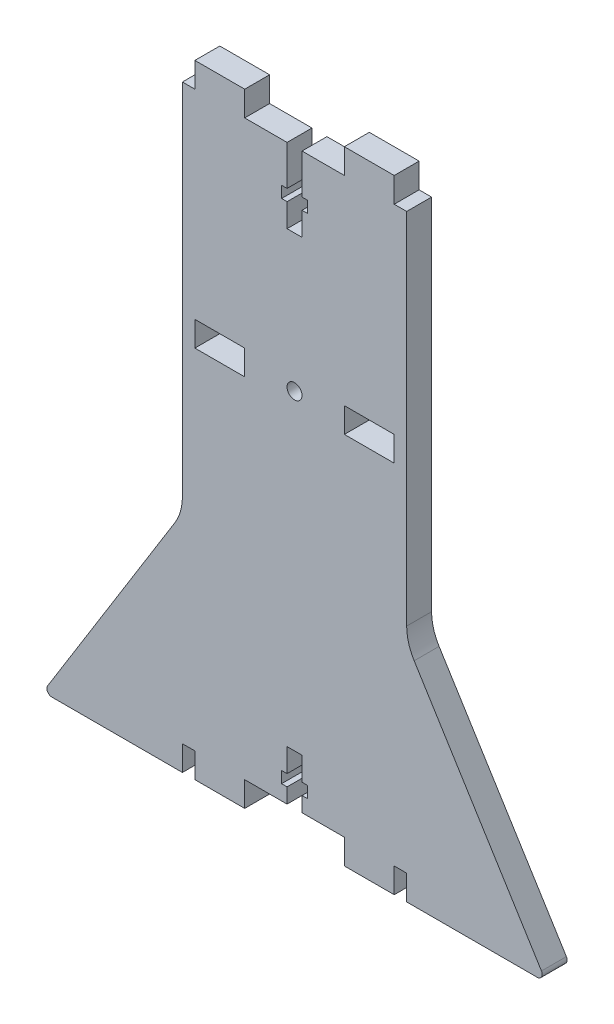
from build123d import *

# Parameters (mm, degrees)
BOSS_EXTRUDE1_DEPTH = 5
SKETCH2_R           = 1.5
SKETCH2_W           = 10
SKETCH2_H           = 5
CUT_EXTRUDE1_DEPTH  = 10
FILLET1_R           = 10
FILLET2_R           = 1


with BuildPart() as part:
    # Sketch1 → Boss-Extrude1 (new body)
    with BuildSketch(Plane.XY):
        Polygon((-32.518889855, -56.191512275), (-30.018889855, -56.191512275), (-30.018889855, -61.191512275), (-20.018889855, -61.191512275), (-20.018889855, -56.191512275), (-11.518889855, -56.191512275), (-11.518889855, -53.191512275), (-12.618889855, -53.191512275), (-12.618889855, -50.891512275), (-11.518889855, -50.891512275), (-11.518889855, -46.191512275), (-8.518889855, -46.191512275), (-8.518889855, -50.891512275), (-7.418889855, -50.891512275), (-7.418889855, -53.191512275), (-8.518889855, -53.191512275), (-8.518889855, -56.191512275), (-0.018889855, -56.191512275), (-0.018889855, -61.191512275), (9.981110145, -61.191512275), (9.981110145, -56.191512275), (12.481110145, -56.191512275), (12.481110145, -61.191512275), (40.481110145, -61.191512275), (12.481110145, -16.103821473), (12.481110145, 58.808487725), (9.981110145, 58.808487725), (9.981110145, 63.808487725), (-0.018889855, 63.808487725), (-0.018889855, 58.808487725), (-8.518889855, 58.808487725), (-8.518889855, 50.808487725), (-7.418889855, 50.808487725), (-7.418889855, 48.508487725), (-8.518889855, 48.508487725), (-8.518889855, 43.808487725), (-11.518889855, 43.808487725), (-11.518889855, 48.508487725), (-12.618889855, 48.508487725), (-12.618889855, 50.808487725), (-11.518889855, 50.808487725), (-11.518889855, 58.808487725), (-20.018889855, 58.808487725), (-20.018889855, 63.808487725), (-30.018889855, 63.808487725), (-30.018889855, 58.808487725), (-32.518889855, 58.808487725), (-32.518889855, -16.103821473), (-60.518889855, -61.191512275), (-32.518889855, -61.191512275), align=None)
    extrude(amount=BOSS_EXTRUDE1_DEPTH)

    # Sketch2 → Cut-Extrude1 (cut)
    with BuildSketch(Plane.XY.offset(5)):
        with Locations((-10.018889855, 16.308487725)):
            Circle(SKETCH2_R)
        with Locations((-25.018889855, 16.308487725)):
            Rectangle(SKETCH2_W, SKETCH2_H)
        with Locations((4.981110145, 16.308487725)):
            Rectangle(SKETCH2_W, SKETCH2_H)
    extrude(amount=-CUT_EXTRUDE1_DEPTH, mode=Mode.SUBTRACT)

    # Fillet1
    fillet1_edges = [part.edges().sort_by_distance(p)[0] for p in [
        (-32.518889855, -16.103821473, 2.5),
        (12.481110145, -16.103821473, 2.5),
    ]]
    fillet(fillet1_edges, radius=FILLET1_R)

    # Fillet2
    fillet2_edges = [part.edges().sort_by_distance(p)[0] for p in [
        (40.481110145, -61.191512275, 2.5),
        (-60.518889855, -61.191512275, 2.5),
    ]]
    fillet(fillet2_edges, radius=FILLET2_R)


solid = part.part
